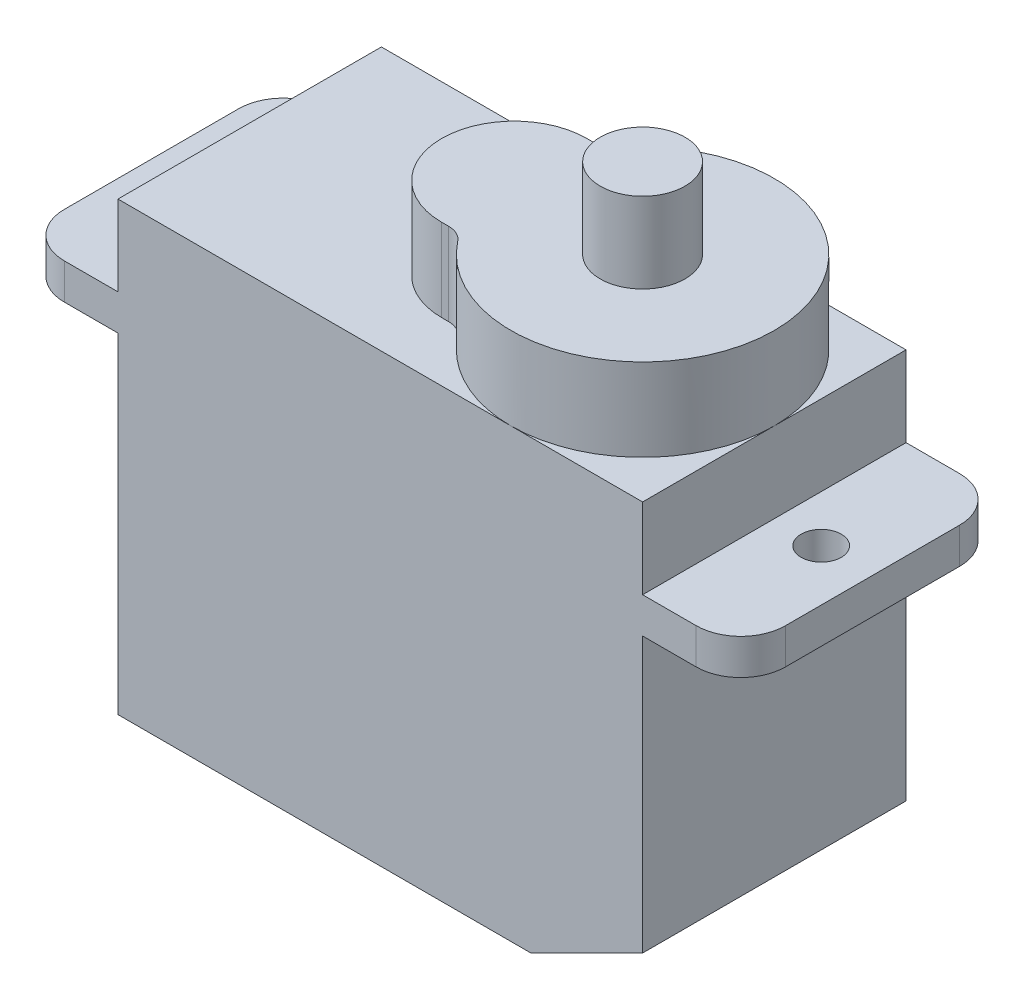
from build123d import *

# Parameters (mm, degrees)
DODANIE_WYCI_GNI_CIE1_DEPTH = 11.8
SZKIC2_R                    = 0.9
WYTNIJ_WYCI_GNI_CIE1_DEPTH  = 11.8
ZAOKR_GLENIE1_R             = 2
DODANIE_WYCI_GNI_CIE2_DEPTH = 3.7
SZKIC4_R                    = 1.9
DODANIE_WYCI_GNI_CIE3_DEPTH = 3.6


with BuildPart() as part:
    # Szkic1 → Dodanie-wyciągnięcie1 (new body)
    with BuildSketch(Plane.XY):
        Polygon((0, 0), (0, 14.8), (-4.4, 14.8), (-4.4, 16.4), (0, 16.4), (0, 20), (23.5, 20), (23.5, 16.4), (27.9, 16.4), (27.9, 14.8), (23.5, 14.8), (23.5, 2.5), (18.5, 0), align=None)
    extrude(amount=DODANIE_WYCI_GNI_CIE1_DEPTH)

    # Szkic2 → Wytnij-wyciągnięcie1 (cut)
    with BuildSketch(Plane(origin=(0, 16.4, 0), x_dir=(1, 0, 0), z_dir=(0, 1, 0))):
        with Locations(Location((-2.1, -5.9, 0), (0, 0, 180))):
            Circle(SZKIC2_R)
        with Locations(Location((25.6, -5.9, 0), (0, 0, 180))):
            Circle(SZKIC2_R)
    extrude(amount=-WYTNIJ_WYCI_GNI_CIE1_DEPTH, mode=Mode.SUBTRACT)

    # Zaokrąglenie1
    zaokr_glenie1_edges = [part.edges().sort_by_distance(p)[0] for p in [
        (-4.4, 15.6, 0),
        (27.9, 15.6, 0),
        (27.9, 15.6, 11.8),
        (-4.4, 15.6, 11.8),
    ]]
    fillet(zaokr_glenie1_edges, radius=ZAOKR_GLENIE1_R)

    # Szkic3 → Dodanie-wyciągnięcie2 (add)
    with BuildSketch(Plane(origin=(0, 20, 0), x_dir=(1, 0, 0), z_dir=(0, 1, 0))):
        with BuildLine():
            Line((11.85, -2.65), (12.164238784, -2.65))
            ThreePointArc((12.164238784, -2.65), (12.602449904, -2.548872079), (12.952030264, -2.265942029))
            ThreePointArc((12.952030264, -2.265942029), (23.5, -5.9), (12.952030264, -9.534057971))
            ThreePointArc((12.952030264, -9.534057971), (12.602449904, -9.251127921), (12.164238784, -9.15))
            Line((12.164238784, -9.15), (11.85, -9.15))
            ThreePointArc((11.85, -9.15), (8.6, -5.9), (11.85, -2.65))
        make_face()
    extrude(amount=DODANIE_WYCI_GNI_CIE2_DEPTH)

    # Szkic4 → Dodanie-wyciągnięcie3 (add)
    with BuildSketch(Plane(origin=(0, 23.7, 0), x_dir=(1, 0, 0), z_dir=(0, 1, 0))):
        with Locations(Location((17.6, -5.9, 0), (0, 0, 270))):
            Circle(SZKIC4_R)
    extrude(amount=DODANIE_WYCI_GNI_CIE3_DEPTH)


solid = part.part
